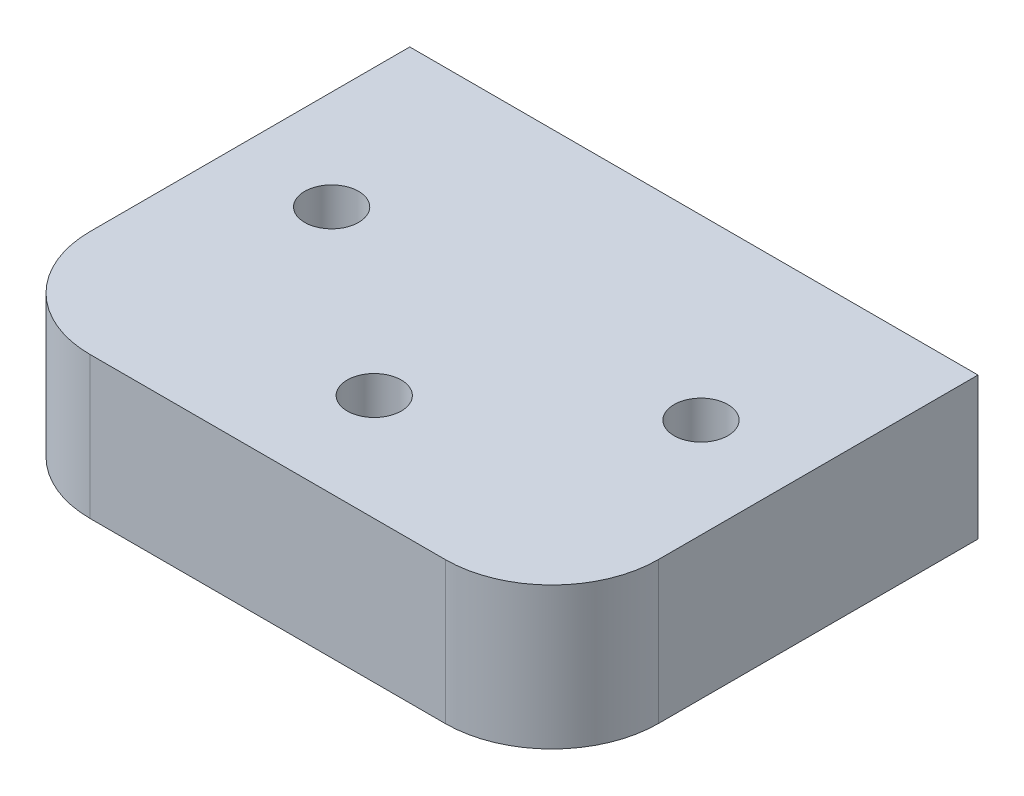
from build123d import *

# Parameters (mm, degrees)
BOSS_EXTRUDE1_DEPTH       = 10
F_6_CLEARANCE_HOLE1_D     = 3.7973
F_6_32_TAPPED_HOLE1_D     = 2.7051
F_6_32_TAPPED_HOLE1_DEPTH = 9.53
F_6_32_TAPPED_HOLE1_TIP   = 0.81269403


with BuildPart() as part:
    # Sketch1 → Boss-Extrude1 (new body)
    with BuildSketch(Plane(origin=(0, 0, 0), x_dir=(1, 0, 0), z_dir=(0, 1, 0))):
        with BuildLine():
            Line((0, 0), (40, 0))
            Line((40, 0), (40, -22.5))
            ThreePointArc((40, -22.5), (37.803300859, -27.803300859), (32.5, -30))
            Line((32.5, -30), (7.5, -30))
            ThreePointArc((7.5, -30), (2.196699141, -27.803300859), (0, -22.5))
            Line((0, -22.5), (0, 0))
        make_face()
    extrude(amount=BOSS_EXTRUDE1_DEPTH)

    # #6 Clearance Hole1 (through all)
    with Locations(Plane(origin=(0, 10, 0), x_dir=(1, 0, 0), z_dir=(0, 1, 0))):
        with Locations((7, -12.5), (33, -12.5), (20, -22.5)):
            Hole(F_6_CLEARANCE_HOLE1_D / 2)

    # #6-32 Tapped Hole1
    with Locations(Plane(origin=(0, 0, 0), x_dir=(-1, 0, 0), z_dir=(0, 0, -1))):
        with Locations((-32.5, 5), (-20, 5), (-7.5, 5)):
            Hole(F_6_32_TAPPED_HOLE1_D / 2, depth=F_6_32_TAPPED_HOLE1_DEPTH)
            with Locations((0, 0, -(F_6_32_TAPPED_HOLE1_DEPTH + F_6_32_TAPPED_HOLE1_TIP / 2))):  # 118° drill point
                Cone(0, F_6_32_TAPPED_HOLE1_D / 2, F_6_32_TAPPED_HOLE1_TIP, mode=Mode.SUBTRACT)


solid = part.part
